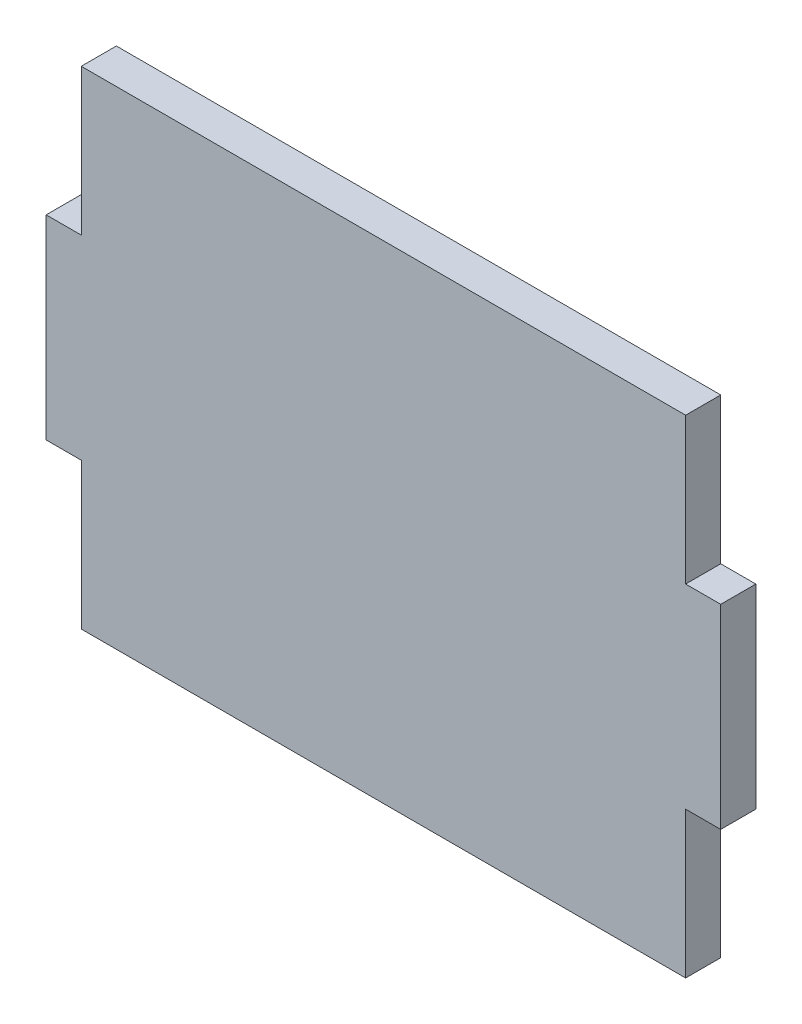
from build123d import *

# Parameters (mm, degrees)
BOSS_EXTRUDE2_DEPTH = 18


with BuildPart() as part:
    # Sketch1 → Boss-Extrude2 (new body)
    with BuildSketch(Plane.XY):
        Polygon((0, -175), (0, -250), (310, -250), (310, -175), (328, -175), (328, -75), (310, -75), (310, 0), (0, 0), (0, -75), (-18, -75), (-18, -175), align=None)
    extrude(amount=BOSS_EXTRUDE2_DEPTH)


solid = part.part
